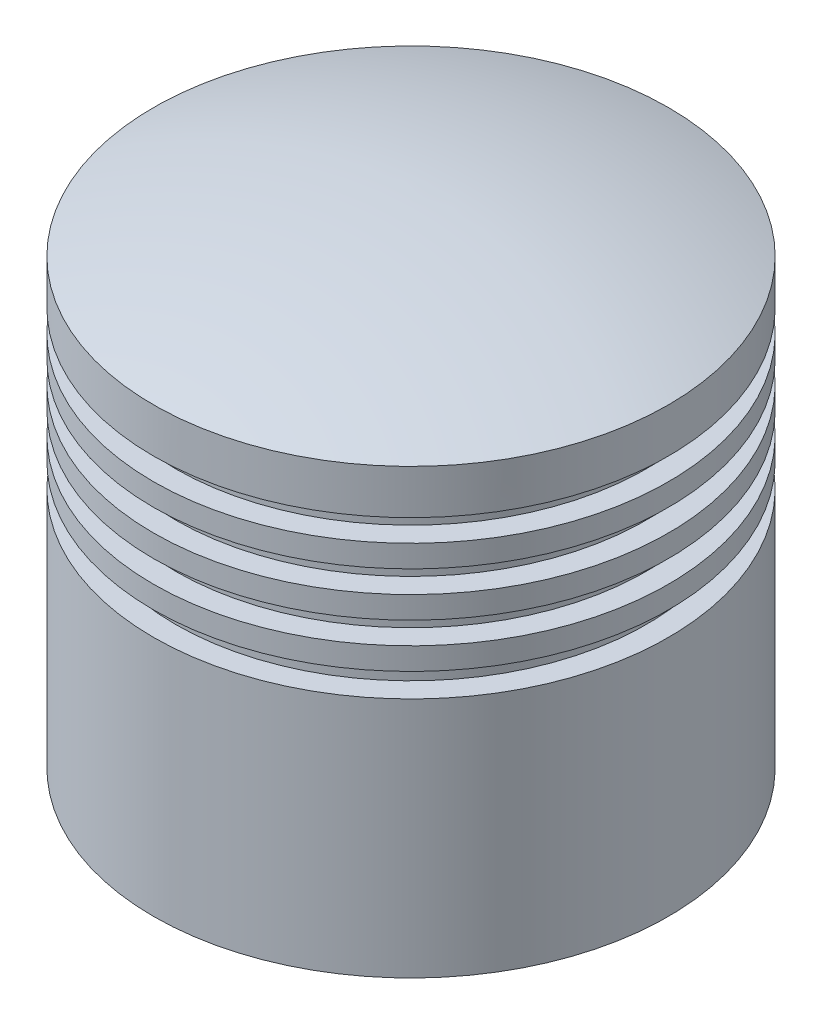
from build123d import *


with BuildPart() as part:
    # Sketch1 → Revolve1 (revolve)
    with BuildSketch(Plane.XY, mode=Mode.PRIVATE) as revolve1_sk:
        with BuildLine():
            Line((50, 0), (58, 0))
            Line((58, 0), (58, 54.437769177))
            Line((58, 54.437769177), (53, 54.437769177))
            Line((53, 54.437769177), (53, 59.799874844))
            Line((53, 59.799874844), (58, 59.799874844))
            Line((58, 59.799874844), (58, 64.799874844))
            Line((58, 64.799874844), (53, 64.799874844))
            Line((53, 64.799874844), (53, 69.799874844))
            Line((53, 69.799874844), (58, 69.799874844))
            Line((58, 69.799874844), (58, 74.799874844))
            Line((58, 74.799874844), (53, 74.799874844))
            Line((53, 74.799874844), (53, 79.799874844))
            Line((53, 79.799874844), (58, 79.799874844))
            Line((58, 79.799874844), (58, 84.799874844))
            Line((58, 84.799874844), (53, 84.799874844))
            Line((53, 84.799874844), (53, 89.799874844))
            Line((53, 89.799874844), (58, 89.799874844))
            Line((58, 89.799874844), (58, 99.799874844))
            ThreePointArc((58, 99.799874844), (29.445044376, 107.430550861), (0, 110))
            Line((0, 110), (0, 103))
            ThreePointArc((0, 103), (21.692969078, 101.550038974), (43, 97.225952056))
            Line((43, 97.225952056), (43, 30))
            Line((43, 30), (50, 30))
            Line((50, 30), (50, 0))
        make_face()
    revolve(revolve1_sk.sketch.rotate(Axis((0, 0, 0), (0, 1, 0)), 90), axis=Axis((0, 0, 0), (0, 1, 0)))


solid = part.part
